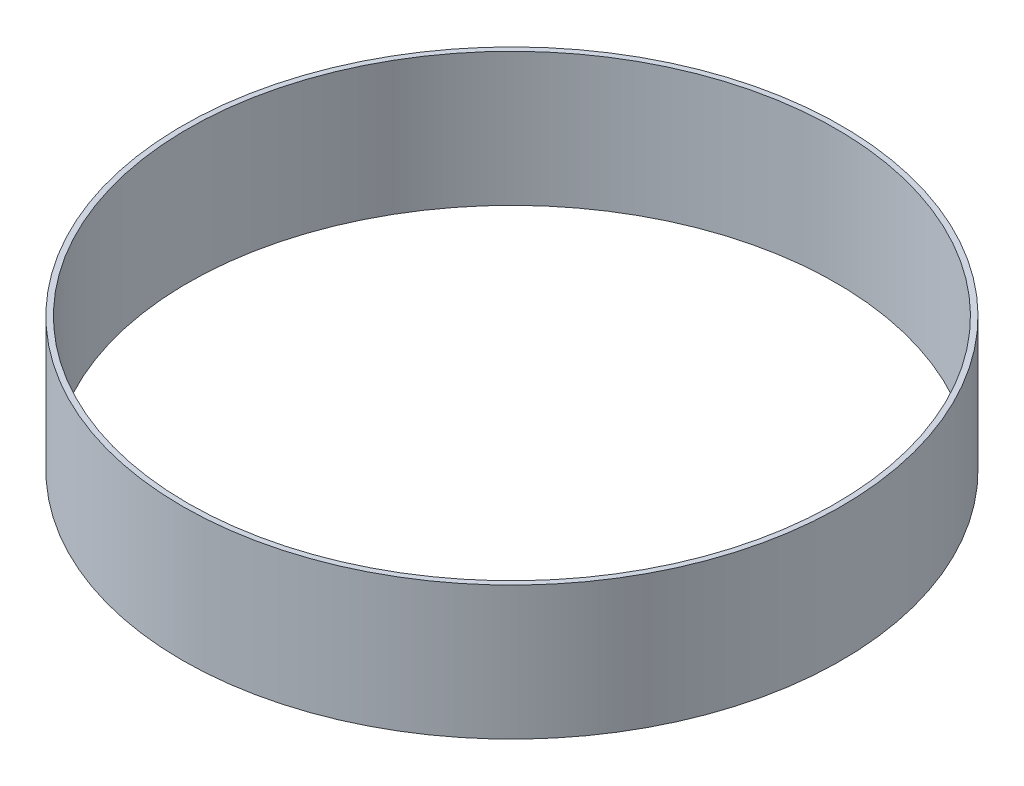
from build123d import *

# Parameters (mm, degrees)
SKETCH1_R           = 123.5
SKETCH1_R_2         = 121.5
BOSS_EXTRUDE1_DEPTH = 25


with BuildPart() as part:
    # Sketch1 → Boss-Extrude1 (new, symmetric)
    with BuildSketch(Plane(origin=(0, 0, 0), x_dir=(1, 0, 0), z_dir=(0, 1, 0))):
        with Locations(Location((0, 0, 0), (0, 0, 270))):
            Circle(SKETCH1_R)
        with Locations(Location((0, 0, 0), (0, 0, 270))):
            Circle(SKETCH1_R_2, mode=Mode.SUBTRACT)
    extrude(amount=BOSS_EXTRUDE1_DEPTH, both=True)


solid = part.part
